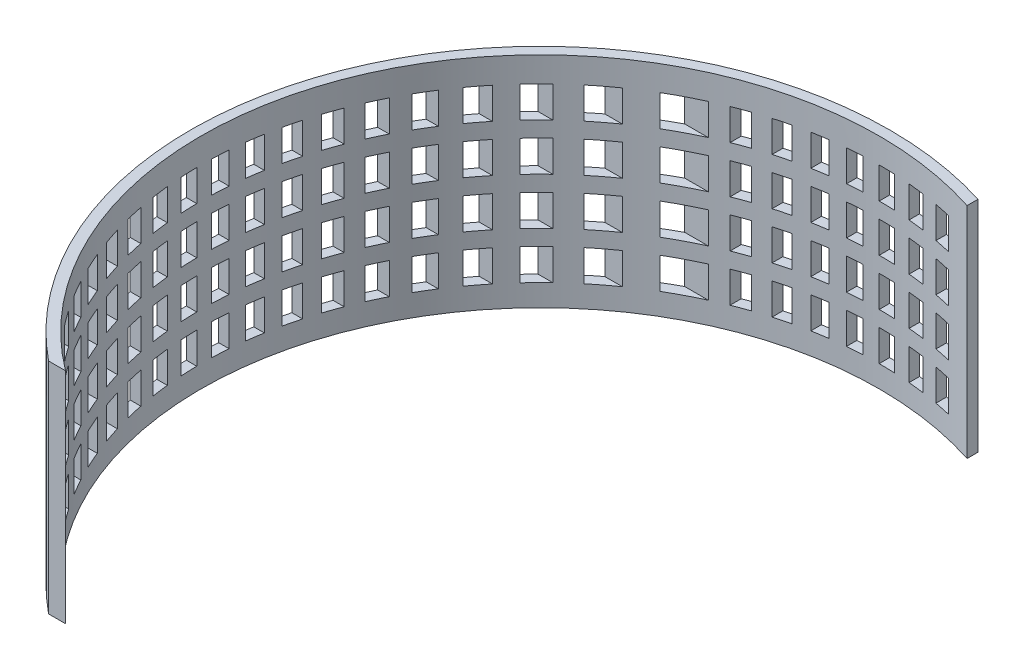
from build123d import *

# Parameters (mm, degrees)
EXTRUDE_1_DEPTH     = 21
SKETCH_2_W          = 1.5916315
SKETCH_2_H          = 3
CUT_EXTRUDE_1_DEPTH = 52.82181008
SKETCH_3_W          = 1.5
SKETCH_3_H          = 3
CUT_EXTRUDE_2_DEPTH = 52.82181008


with BuildPart() as part:
    # 草图1 → 凸台-拉伸1 (new body)
    with BuildSketch(Plane(origin=(0, 0, 0), x_dir=(1, 0, 0), z_dir=(0, 1, 0))):
        with BuildLine():
            Line((10, 31.972644557), (10, 30.923292192))
            ThreePointArc((10, 30.923292192), (-28.85529065, 14.954002859), (-19.5, -26))
            Line((-19.5, -26), (-21.124630174, -26))
            ThreePointArc((-21.124630174, -26), (-29.515186403, 15.846254183), (10, 31.972644557))
        make_face()
    extrude(amount=EXTRUDE_1_DEPTH)

    # 草图2 → 切除-拉伸1 (cut, through all)
    with BuildSketch(Plane(origin=(0, 0, 0), x_dir=(0, 0, -1), z_dir=(1, 0, 0))):
        with Locations((-19.214231765, 17.088266934)):
            Rectangle(SKETCH_2_W, SKETCH_2_H)
        with Locations((-22.214231765, 17.088266934)):
            Rectangle(SKETCH_2_W, SKETCH_2_H)
        with Locations((-16.214231765, 17.088266934)):
            Rectangle(SKETCH_2_W, SKETCH_2_H)
        with Locations((-13.214231765, 17.088266934)):
            Rectangle(SKETCH_2_W, SKETCH_2_H)
        with Locations((-10.214231765, 17.088266934)):
            Rectangle(SKETCH_2_W, SKETCH_2_H)
        with Locations((-7.214231765, 17.088266934)):
            Rectangle(SKETCH_2_W, SKETCH_2_H)
        with Locations((-4.214231765, 17.088266934)):
            Rectangle(SKETCH_2_W, SKETCH_2_H)
        with Locations((-1.214231765, 17.088266934)):
            Rectangle(SKETCH_2_W, SKETCH_2_H)
        with Locations((1.785768235, 17.088266934)):
            Rectangle(SKETCH_2_W, SKETCH_2_H)
        with Locations((4.785768235, 17.088266934)):
            Rectangle(SKETCH_2_W, SKETCH_2_H)
        with Locations((7.785768235, 17.088266934)):
            Rectangle(SKETCH_2_W, SKETCH_2_H)
        with Locations((10.785768235, 17.088266934)):
            Rectangle(SKETCH_2_W, SKETCH_2_H)
        with Locations((13.785768235, 17.088266934)):
            Rectangle(SKETCH_2_W, SKETCH_2_H)
        with Locations((16.785768235, 17.088266934)):
            Rectangle(SKETCH_2_W, SKETCH_2_H)
        with Locations((19.785768235, 17.088266934)):
            Rectangle(SKETCH_2_W, SKETCH_2_H)
        with Locations((22.785768235, 17.088266934)):
            Rectangle(SKETCH_2_W, SKETCH_2_H)
        with Locations((25.785768235, 17.088266934)):
            Rectangle(SKETCH_2_W, SKETCH_2_H)
        with Locations((28.785768235, 17.088266934)):
            Rectangle(SKETCH_2_W, SKETCH_2_H)
        with Locations((28.785768235, 12.588266934)):
            Rectangle(SKETCH_2_W, SKETCH_2_H)
        with Locations((25.785768235, 12.588266934)):
            Rectangle(SKETCH_2_W, SKETCH_2_H)
        with Locations((22.785768235, 12.588266934)):
            Rectangle(SKETCH_2_W, SKETCH_2_H)
        with Locations((19.785768235, 12.588266934)):
            Rectangle(SKETCH_2_W, SKETCH_2_H)
        with Locations((16.785768235, 12.588266934)):
            Rectangle(SKETCH_2_W, SKETCH_2_H)
        with Locations((13.785768235, 12.588266934)):
            Rectangle(SKETCH_2_W, SKETCH_2_H)
        with Locations((10.785768235, 12.588266934)):
            Rectangle(SKETCH_2_W, SKETCH_2_H)
        with Locations((7.785768235, 12.588266934)):
            Rectangle(SKETCH_2_W, SKETCH_2_H)
        with Locations((4.785768235, 12.588266934)):
            Rectangle(SKETCH_2_W, SKETCH_2_H)
        with Locations((1.785768235, 12.588266934)):
            Rectangle(SKETCH_2_W, SKETCH_2_H)
        with Locations((-1.214231765, 12.588266934)):
            Rectangle(SKETCH_2_W, SKETCH_2_H)
        with Locations((-4.214231765, 12.588266934)):
            Rectangle(SKETCH_2_W, SKETCH_2_H)
        with Locations((-7.214231765, 12.588266934)):
            Rectangle(SKETCH_2_W, SKETCH_2_H)
        with Locations((-10.214231765, 12.588266934)):
            Rectangle(SKETCH_2_W, SKETCH_2_H)
        with Locations((-13.214231765, 12.588266934)):
            Rectangle(SKETCH_2_W, SKETCH_2_H)
        with Locations((-16.214231765, 12.588266934)):
            Rectangle(SKETCH_2_W, SKETCH_2_H)
        with Locations((-19.214231765, 12.588266934)):
            Rectangle(SKETCH_2_W, SKETCH_2_H)
        with Locations((-22.214231765, 12.588266934)):
            Rectangle(SKETCH_2_W, SKETCH_2_H)
        with Locations((28.785768235, 8.088266934)):
            Rectangle(SKETCH_2_W, SKETCH_2_H)
        with Locations((25.785768235, 8.088266934)):
            Rectangle(SKETCH_2_W, SKETCH_2_H)
        with Locations((22.785768235, 8.088266934)):
            Rectangle(SKETCH_2_W, SKETCH_2_H)
        with Locations((19.785768235, 8.088266934)):
            Rectangle(SKETCH_2_W, SKETCH_2_H)
        with Locations((16.785768235, 8.088266934)):
            Rectangle(SKETCH_2_W, SKETCH_2_H)
        with Locations((13.785768235, 8.088266934)):
            Rectangle(SKETCH_2_W, SKETCH_2_H)
        with Locations((10.785768235, 8.088266934)):
            Rectangle(SKETCH_2_W, SKETCH_2_H)
        with Locations((7.785768235, 8.088266934)):
            Rectangle(SKETCH_2_W, SKETCH_2_H)
        with Locations((4.785768235, 8.088266934)):
            Rectangle(SKETCH_2_W, SKETCH_2_H)
        with Locations((1.785768235, 8.088266934)):
            Rectangle(SKETCH_2_W, SKETCH_2_H)
        with Locations((-1.214231765, 8.088266934)):
            Rectangle(SKETCH_2_W, SKETCH_2_H)
        with Locations((-4.214231765, 8.088266934)):
            Rectangle(SKETCH_2_W, SKETCH_2_H)
        with Locations((-7.214231765, 8.088266934)):
            Rectangle(SKETCH_2_W, SKETCH_2_H)
        with Locations((-10.214231765, 8.088266934)):
            Rectangle(SKETCH_2_W, SKETCH_2_H)
        with Locations((-13.214231765, 8.088266934)):
            Rectangle(SKETCH_2_W, SKETCH_2_H)
        with Locations((-16.214231765, 8.088266934)):
            Rectangle(SKETCH_2_W, SKETCH_2_H)
        with Locations((-19.214231765, 8.088266934)):
            Rectangle(SKETCH_2_W, SKETCH_2_H)
        with Locations((-22.214231765, 8.088266934)):
            Rectangle(SKETCH_2_W, SKETCH_2_H)
        with Locations((28.785768235, 3.588266934)):
            Rectangle(SKETCH_2_W, SKETCH_2_H)
        with Locations((25.785768235, 3.588266934)):
            Rectangle(SKETCH_2_W, SKETCH_2_H)
        with Locations((22.785768235, 3.588266934)):
            Rectangle(SKETCH_2_W, SKETCH_2_H)
        with Locations((19.785768235, 3.588266934)):
            Rectangle(SKETCH_2_W, SKETCH_2_H)
        with Locations((16.785768235, 3.588266934)):
            Rectangle(SKETCH_2_W, SKETCH_2_H)
        with Locations((13.785768235, 3.588266934)):
            Rectangle(SKETCH_2_W, SKETCH_2_H)
        with Locations((10.785768235, 3.588266934)):
            Rectangle(SKETCH_2_W, SKETCH_2_H)
        with Locations((7.785768235, 3.588266934)):
            Rectangle(SKETCH_2_W, SKETCH_2_H)
        with Locations((4.785768235, 3.588266934)):
            Rectangle(SKETCH_2_W, SKETCH_2_H)
        with Locations((1.785768235, 3.588266934)):
            Rectangle(SKETCH_2_W, SKETCH_2_H)
        with Locations((-1.214231765, 3.588266934)):
            Rectangle(SKETCH_2_W, SKETCH_2_H)
        with Locations((-4.214231765, 3.588266934)):
            Rectangle(SKETCH_2_W, SKETCH_2_H)
        with Locations((-7.214231765, 3.588266934)):
            Rectangle(SKETCH_2_W, SKETCH_2_H)
        with Locations((-10.214231765, 3.588266934)):
            Rectangle(SKETCH_2_W, SKETCH_2_H)
        with Locations((-13.214231765, 3.588266934)):
            Rectangle(SKETCH_2_W, SKETCH_2_H)
        with Locations((-16.214231765, 3.588266934)):
            Rectangle(SKETCH_2_W, SKETCH_2_H)
        with Locations((-19.214231765, 3.588266934)):
            Rectangle(SKETCH_2_W, SKETCH_2_H)
        with Locations((-22.214231765, 3.588266934)):
            Rectangle(SKETCH_2_W, SKETCH_2_H)
    extrude(amount=-CUT_EXTRUDE_1_DEPTH, mode=Mode.SUBTRACT)

    # 草图3 → 切除-拉伸2 (cut, through all)
    with BuildSketch(Plane.XY):
        with Locations((6.75, 17.088266934)):
            Rectangle(SKETCH_3_W, SKETCH_3_H)
        with Locations((3.75, 17.088266934)):
            Rectangle(SKETCH_3_W, SKETCH_3_H)
        with Locations((0.75, 17.088266934)):
            Rectangle(SKETCH_3_W, SKETCH_3_H)
        with Locations((-2.25, 17.088266934)):
            Rectangle(SKETCH_3_W, SKETCH_3_H)
        with Locations((-5.25, 17.088266934)):
            Rectangle(SKETCH_3_W, SKETCH_3_H)
        with Locations((-8.25, 17.088266934)):
            Rectangle(SKETCH_3_W, SKETCH_3_H)
        with Locations((-11.25, 17.088266934)):
            Rectangle(SKETCH_3_W, SKETCH_3_H)
        with Locations((6.75, 12.588266934)):
            Rectangle(SKETCH_3_W, SKETCH_3_H)
        with Locations((-11.25, 12.588266934)):
            Rectangle(SKETCH_3_W, SKETCH_3_H)
        with Locations((-8.25, 12.588266934)):
            Rectangle(SKETCH_3_W, SKETCH_3_H)
        with Locations((-5.25, 12.588266934)):
            Rectangle(SKETCH_3_W, SKETCH_3_H)
        with Locations((-2.25, 12.588266934)):
            Rectangle(SKETCH_3_W, SKETCH_3_H)
        with Locations((0.75, 12.588266934)):
            Rectangle(SKETCH_3_W, SKETCH_3_H)
        with Locations((3.75, 12.588266934)):
            Rectangle(SKETCH_3_W, SKETCH_3_H)
        with Locations((6.75, 8.088266934)):
            Rectangle(SKETCH_3_W, SKETCH_3_H)
        with Locations((-11.25, 8.088266934)):
            Rectangle(SKETCH_3_W, SKETCH_3_H)
        with Locations((-8.25, 8.088266934)):
            Rectangle(SKETCH_3_W, SKETCH_3_H)
        with Locations((-5.25, 8.088266934)):
            Rectangle(SKETCH_3_W, SKETCH_3_H)
        with Locations((-2.25, 8.088266934)):
            Rectangle(SKETCH_3_W, SKETCH_3_H)
        with Locations((0.75, 8.088266934)):
            Rectangle(SKETCH_3_W, SKETCH_3_H)
        with Locations((3.75, 8.088266934)):
            Rectangle(SKETCH_3_W, SKETCH_3_H)
        with Locations((6.75, 3.588266934)):
            Rectangle(SKETCH_3_W, SKETCH_3_H)
        with Locations((-11.25, 3.588266934)):
            Rectangle(SKETCH_3_W, SKETCH_3_H)
        with Locations((-8.25, 3.588266934)):
            Rectangle(SKETCH_3_W, SKETCH_3_H)
        with Locations((-5.25, 3.588266934)):
            Rectangle(SKETCH_3_W, SKETCH_3_H)
        with Locations((-2.25, 3.588266934)):
            Rectangle(SKETCH_3_W, SKETCH_3_H)
        with Locations((0.75, 3.588266934)):
            Rectangle(SKETCH_3_W, SKETCH_3_H)
        with Locations((3.75, 3.588266934)):
            Rectangle(SKETCH_3_W, SKETCH_3_H)
    extrude(amount=-CUT_EXTRUDE_2_DEPTH, mode=Mode.SUBTRACT)


solid = part.part
